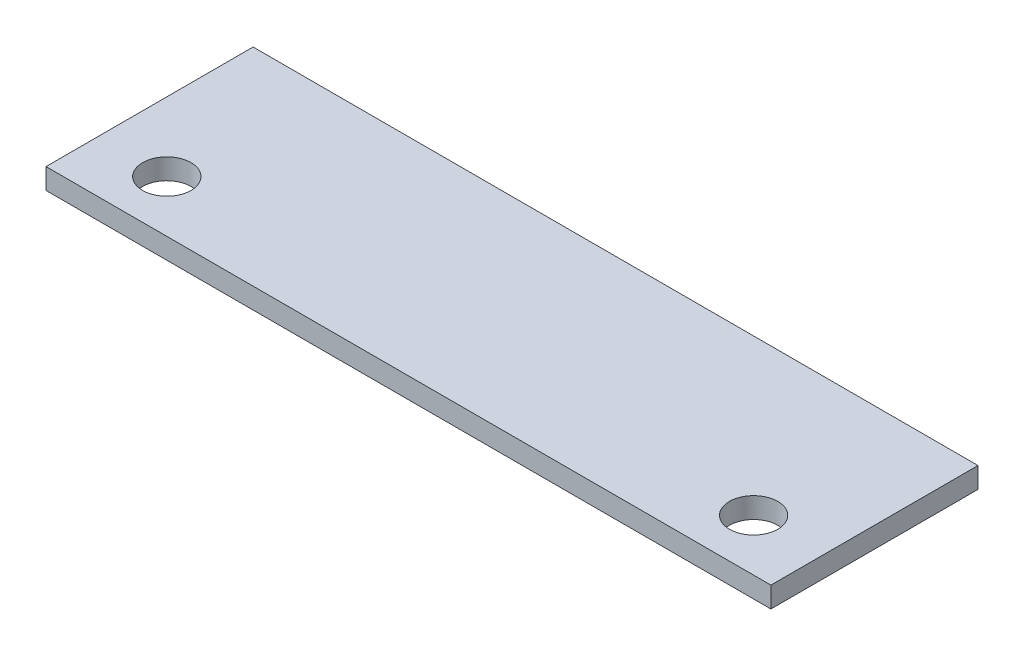
from build123d import *

# Parameters (mm, degrees)
SKETCH1_W               = 210
SKETCH1_H               = 60
BOSS_EXTRUDE1_DEPTH     = 6
CUT_EXTRUDE1_DEPTH      = 110.366356801
CUT_EXTRUDE1_DEPTH_BACK = 110.366356801
SKETCH2_R               = 7


with BuildPart() as part:
    # Sketch1 → Boss-Extrude1 (new body)
    with BuildSketch(Plane(origin=(0, 0, 0), x_dir=(1, 0, 0), z_dir=(0, 1, 0))):
        Rectangle(SKETCH1_W, SKETCH1_H)
    extrude(amount=BOSS_EXTRUDE1_DEPTH)

    # Sketch2 → Cut-Extrude1 (cut, two sides: drawn at the far end of the back side and taken through both)
    with BuildSketch(Plane(origin=(0, 6, 0), x_dir=(1, 0, 0), z_dir=(0, 1, 0)).offset(-CUT_EXTRUDE1_DEPTH_BACK)):
        with Locations(Location((85, -15, 0), (0, 0, 270))):
            Circle(SKETCH2_R)
        with Locations(Location((-85, -15, 0), (0, 0, 270))):
            Circle(SKETCH2_R)
    extrude(amount=CUT_EXTRUDE1_DEPTH + CUT_EXTRUDE1_DEPTH_BACK, mode=Mode.SUBTRACT)


solid = part.part
